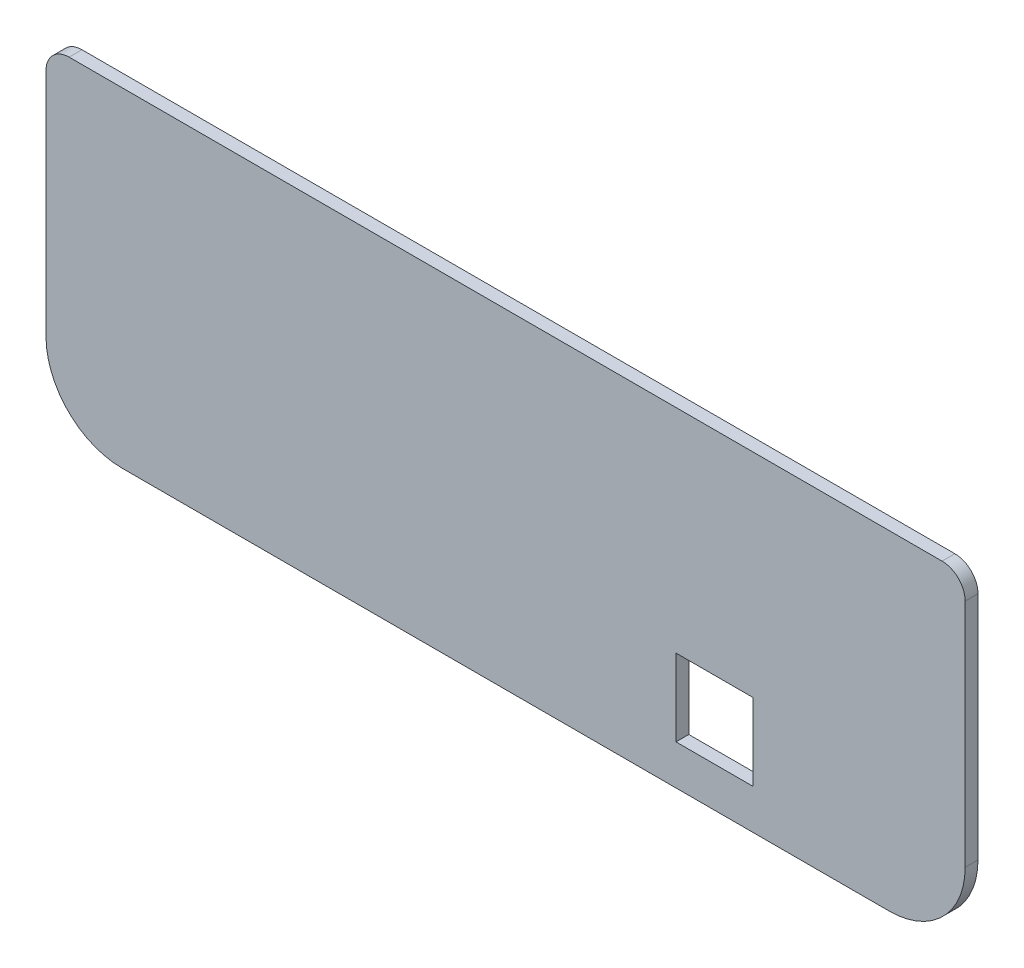
from build123d import *

# Parameters (mm, degrees)
BOSS_EXTRU_1_DEPTH      = 2.5
ESQUISSE21_W            = 15
ESQUISSE21_H            = 15
ENL_V_MAT_EXTRU_1_DEPTH = 10


with BuildPart() as part:
    # Esquisse20 → Boss.-Extru.1 (new body)
    with BuildSketch(Plane.XY):
        with BuildLine():
            Line((14.8, -2), (164.37, -2))
            ThreePointArc((164.37, -2), (174.835180362, 2.334819638), (179.17, 12.8))
            Line((179.17, 12.8), (179.17, 57.73))
            ThreePointArc((179.17, 57.73), (177.851980515, 60.911980515), (174.67, 62.23))
            Line((174.67, 62.23), (4.5, 62.23))
            ThreePointArc((4.5, 62.23), (1.318019485, 60.911980515), (0, 57.73))
            Line((0, 57.73), (0, 12.8))
            ThreePointArc((0, 12.8), (4.334819638, 2.334819638), (14.8, -2))
        make_face()
    extrude(amount=BOSS_EXTRU_1_DEPTH)

    # Esquisse21 → Enlèv. mat.-Extru.1 (cut)
    with BuildSketch(Plane(origin=(0, 0, 0), x_dir=(-1, 0, 0), z_dir=(0, 0, -1))):
        with Locations((-130.294905016, 13.280151044)):
            Rectangle(ESQUISSE21_W, ESQUISSE21_H)
    extrude(amount=-ENL_V_MAT_EXTRU_1_DEPTH, mode=Mode.SUBTRACT)


solid = part.part
